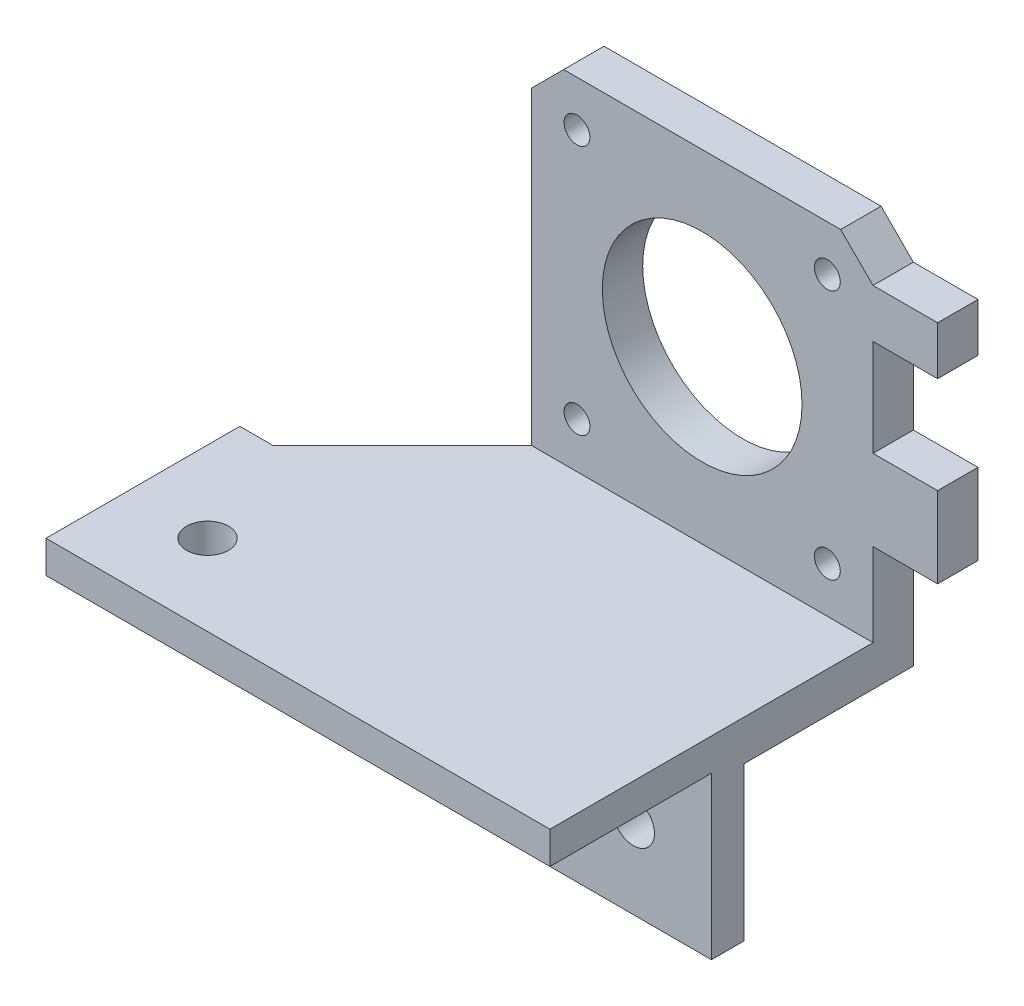
from build123d import *

# Parameters (mm, degrees)
SKICA1_W                 = 62.391596743
SKICA1_H                 = 24
P_IDAT_VYSUNUT_M1_DEPTH  = 4
SKICA2_W                 = 42.3
SKICA2_H                 = 5
P_IDAT_VYSUNUT_M2_DEPTH  = 16
SKICA3_R                 = 1.6
SKICA3_R_2               = 12.36434098
P_IDAT_VYSUNUT_M5_DEPTH  = 5
ZKOSEN_1_SIZE            = 16
SKICA4_R                 = 2.6
ODEBRAT_VYSUNUT_M1_DEPTH = 4
SKICA5_W                 = 62.391596743
SKICA5_H                 = 4
P_IDAT_VYSUNUT_M6_DEPTH  = 20
SKICA6_R                 = 2.6
ODEBRAT_VYSUNUT_M2_DEPTH = 4
SKICA7_W                 = 52.547851764
SKICA7_H                 = 73.400173893
ODEBRAT_VYSUNUT_M3_DEPTH = 80
SKICA8_W                 = 5
SKICA8_H                 = 6
SKICA8_H_2               = 10
P_IDAT_VYSUNUT_M7_DEPTH  = 8


with BuildPart() as part:
    # Skica1 → Přidat vysunutím1 (new body)
    with BuildSketch(Plane.XY):
        with Locations((-71.195798372, -0.971059771)):
            Rectangle(SKICA1_W, SKICA1_H)
    extrude(amount=P_IDAT_VYSUNUT_M1_DEPTH)

    # Skica2 → Přidat vysunutím2 (add)
    with BuildSketch(Plane.XY.offset(4)):
        with Locations((-61.15, 8.528940229)):
            Rectangle(SKICA2_W, SKICA2_H)
    extrude(amount=P_IDAT_VYSUNUT_M2_DEPTH)

    # Skica3 → Přidat vysunutím5 (add)
    with BuildSketch(Plane.XY.offset(20)):
        Polygon((-40, 6.028940229), (-82.3, 6.028940229), (-82.3, 49.328940229), (-78.3, 53.328940229), (-44, 53.328940229), (-40, 49.328940229), align=None)
        with Locations((-45.65, 47.678940229)):
            Circle(SKICA3_R, mode=Mode.SUBTRACT)
        with Locations((-76.65, 47.678940229)):
            Circle(SKICA3_R, mode=Mode.SUBTRACT)
        with Locations((-76.65, 16.678940229)):
            Circle(SKICA3_R, mode=Mode.SUBTRACT)
        with Locations((-45.65, 16.678940229)):
            Circle(SKICA3_R, mode=Mode.SUBTRACT)
        with Locations((-61.15, 32.178940229)):
            Circle(SKICA3_R_2, mode=Mode.SUBTRACT)
    extrude(amount=P_IDAT_VYSUNUT_M5_DEPTH)

    # Zkosení1
    zkosen_1_edges = [part.edges().sort_by_distance(p)[0] for p in [
        (-82.3, 8.528940229, 4),
    ]]
    chamfer(zkosen_1_edges, length=ZKOSEN_1_SIZE)

    # Skica4 → Odebrat vysunutím1 (cut)
    with BuildSketch(Plane.XY.offset(4)):
        with Locations((-89.655606689, -2.971059771)):
            Circle(SKICA4_R)
        with Locations((-69.655606689, -2.971059771)):
            Circle(SKICA4_R)
        with Locations((-49.655606689, -2.971059771)):
            Circle(SKICA4_R)
    extrude(amount=-ODEBRAT_VYSUNUT_M1_DEPTH, mode=Mode.SUBTRACT)

    # Skica5 → Přidat vysunutím6 (add)
    with BuildSketch(Plane(origin=(0, 0, 0), x_dir=(-1, 0, 0), z_dir=(0, 0, -1))):
        with Locations((71.195798372, 9.028940229)):
            Rectangle(SKICA5_W, SKICA5_H)
    extrude(amount=P_IDAT_VYSUNUT_M6_DEPTH)

    # Skica6 → Odebrat vysunutím2 (cut)
    with BuildSketch(Plane(origin=(0, 11.028940229, 0), x_dir=(1, 0, 0), z_dir=(0, 1, 0))):
        with Locations(Location((-92.391596743, 10, 0), (0, 0, 270))):
            Circle(SKICA6_R)
    extrude(amount=-ODEBRAT_VYSUNUT_M2_DEPTH, mode=Mode.SUBTRACT)


with BuildPart() as body_2:
    # Zrcadlit2: mirrored copy
    add(part.part.mirror(Plane(origin=(-350, -6.109059771, -20), x_dir=(1, 0, 0), z_dir=(0, 0, 1))))

    # Skica8 → Přidat vysunutím7 (add)
    with BuildSketch(Plane(origin=(-40, 0, 0), x_dir=(0, 0, -1), z_dir=(1, 0, 0))):
        with Locations((62.5, 46.328940229)):
            Rectangle(SKICA8_W, SKICA8_H)
        with Locations((62.5, 26.328940229)):
            Rectangle(SKICA8_W, SKICA8_H_2)
    extrude(amount=P_IDAT_VYSUNUT_M7_DEPTH)


with BuildPart() as part_1:
    add(part.part)

    # Skica7 → Odebrat vysunutím3 (cut)
    with BuildSketch(Plane.ZY.offset(102.391596743)):
        with Locations((6.273925882, 18.093708017)):
            Rectangle(SKICA7_W, SKICA7_H)
    extrude(amount=-ODEBRAT_VYSUNUT_M3_DEPTH, mode=Mode.SUBTRACT)


solid = body_2.part
